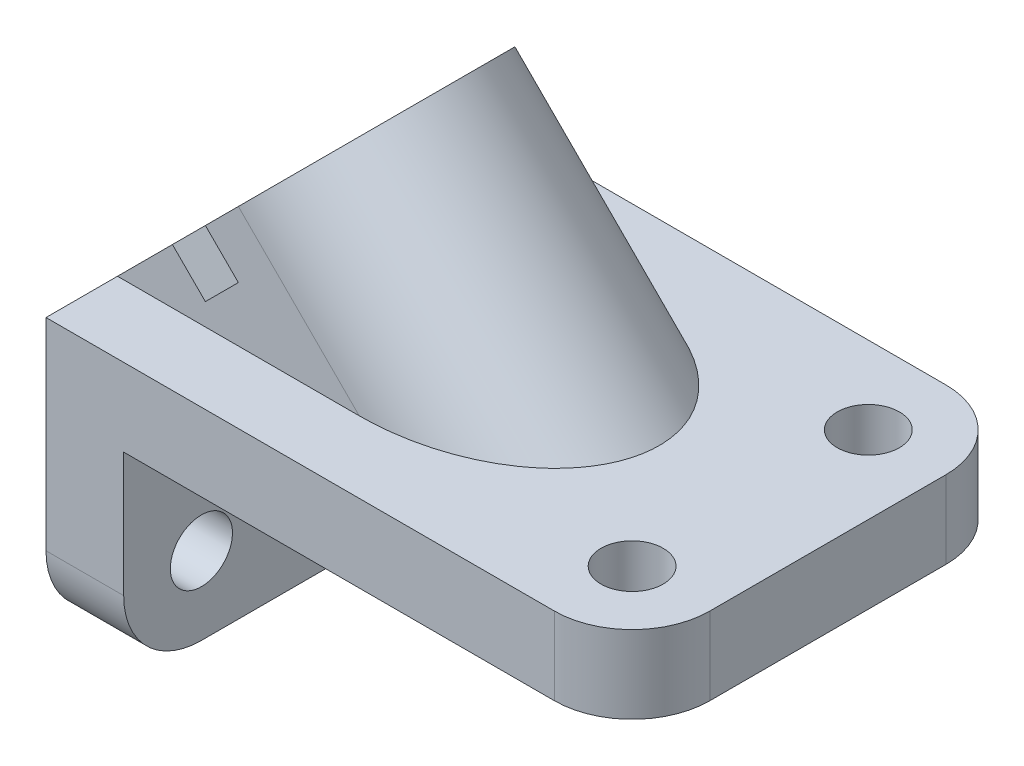
from build123d import *

# Parameters (mm, degrees)
BOSS_EXTRUDE1_DEPTH = 63
FILLET1_R           = 25
SKETCH2_R           = 10
CUT_EXTRUDE1_DEPTH  = 126
SKETCH3_R           = 10
CUT_EXTRUDE2_DEPTH  = 126
BOSS_EXTRUDE2_DEPTH = 40
BOSS_EXTRUDE6_REACH = 208.821
SKETCH10_R          = 40
SKETCH11_R          = 15
CUT_EXTRUDE11_DEPTH = 207.821386
CUT_EXTRUDE12_DEPTH = 90


with BuildPart() as part:
    # Sketch1 → Boss-Extrude1 (new, symmetric)
    with BuildSketch(Plane.XY):
        Polygon((-100.212766, -90), (-100.212766, 0), (88.372089, 0), (88.372089, -25), (-75.212766, -25), (-75.212766, -90), align=None)
    extrude(amount=BOSS_EXTRUDE1_DEPTH, both=True)

    # Fillet1
    fillet1_edges = [part.edges().sort_by_distance(p)[0] for p in [
        (88.372089, -12.5, 63),
        (-87.712766, -90, 63),
        (88.372089, -12.5, -63),
        (-87.712766, -90, -63),
    ]]
    fillet(fillet1_edges, radius=FILLET1_R)

    # Sketch2 → Cut-Extrude1 (cut)
    with BuildSketch(Plane.XZ.offset(25)):
        with Locations(Location((63.372089, -38, 0), (0, 0, 270))):
            Circle(SKETCH2_R)
        with Locations(Location((63.372089, 38, 0), (0, 0, 270))):
            Circle(SKETCH2_R)
    extrude(amount=-CUT_EXTRUDE1_DEPTH, mode=Mode.SUBTRACT)

    # Sketch3 → Cut-Extrude2 (cut)
    with BuildSketch(Plane.ZY.offset(100.212766)):
        with Locations((-38, -65)):
            Circle(SKETCH3_R)
        with Locations((38, -65)):
            Circle(SKETCH3_R)
    extrude(amount=-CUT_EXTRUDE2_DEPTH, mode=Mode.SUBTRACT)

    # Sketch4 → Boss-Extrude2 (add, symmetric)
    with BuildSketch(Plane.XY):
        Polygon((-100.212766, 0), (-61.321893, 38.890873), (-22.43102, 0), align=None)
    extrude(amount=BOSS_EXTRUDE2_DEPTH, both=True)

    # Boss-Extrude6: up to this plane
    boss_extrude6_end = Plane(origin=(-100.212766, 0, 63), z_dir=(0, -1, 0))
    # Sketch10 → Boss-Extrude6 (add, up to the surface)
    with BuildSketch(Plane(origin=(-50.106383, 50.106383, 0), x_dir=(0, 0, 1), z_dir=(-0.7071067811865438, 0.7071067811865512, 0)), mode=Mode.PRIVATE) as boss_extrude6_sk1:
        with Locations((0, -15.861126)):
            Circle(SKETCH10_R)
    boss_extrude6_tool1 = split(extrude(boss_extrude6_sk1.sketch, amount=-BOSS_EXTRUDE6_REACH, mode=Mode.PRIVATE), bisect_by=boss_extrude6_end, keep=Keep.BOTH, mode=Mode.PRIVATE)
    add(boss_extrude6_tool1.solids().sort_by_distance((-61.321893, 38.890873, 0))[0])

    # Sketch11 → Cut-Extrude11 (cut, through all)
    with BuildSketch(Plane(origin=(-50.106383, 50.106383, 0), x_dir=(0, 0, 1), z_dir=(-0.7071067811865438, 0.7071067811865512, 0))):
        with Locations(Location((0, 4.138874, 0), (0, 0, 270))):
            Circle(SKETCH11_R)
    extrude(amount=-CUT_EXTRUDE11_DEPTH, mode=Mode.SUBTRACT)

    # Sketch12 → Cut-Extrude12 (cut)
    with BuildSketch(Plane.XY.offset(40)):
        Polygon((-82.535096, 17.67767), (-71.928495, 7.071068), (-61.321893, 17.67767), (-71.928495, 28.284271), align=None)
    extrude(amount=-CUT_EXTRUDE12_DEPTH, mode=Mode.SUBTRACT)


solid = part.part
